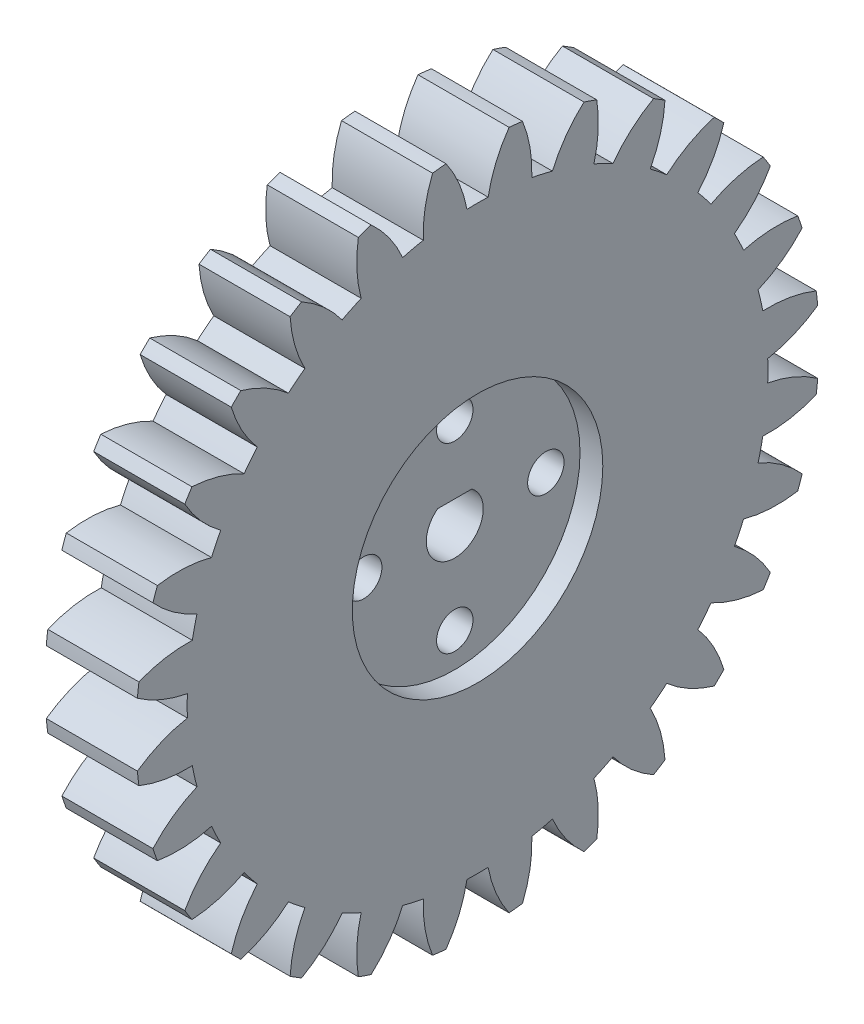
from build123d import *

# Parameters (mm, degrees)
BASPROSKE_W              = 8
BASPROSKE_H              = 30
TOOTHCUT_DEPTH           = 44.17406629
TEETHCUTS_COUNT          = 28
TEETHCUTS_ANGLE          = 347.142857143
BORSKE_R                 = 0.1
BORE_DEPTH               = 50.0000508
TAGLIO_ESTRUSIONE1_DEPTH = 30
SCHIZZO2_R               = 1.6
TAGLIO_ESTRUSIONE2_DEPTH = 10
SCHIZZO3_R               = 11
TAGLIO_ESTRUSIONE3_DEPTH = 2


with BuildPart() as part:
    # BasProSke → Base-Revolve (revolve)
    with BuildSketch(Plane(origin=(0, 0, 0), x_dir=(1, 0, 0), z_dir=(0, 1, 0)), mode=Mode.PRIVATE) as base_revolve_sk:
        with Locations((4, 15)):
            Rectangle(BASPROSKE_W, BASPROSKE_H)
    revolve(base_revolve_sk.sketch.rotate(Axis((-10, 0, 0), (1, 0, 0)), 180), axis=Axis((-10, 0, 0), (1, 0, 0)))

    # TooCutSke → ToothCut (cut, through all)
    with BuildSketch(Plane(origin=(0, 0, 0), x_dir=(0, 0, -1), z_dir=(1, 0, 0))):
        with BuildLine():
            ThreePointArc((0.928503763, 25.482089431), (0, 25.499), (-0.928503763, 25.482089431))
            ThreePointArc((-0.928503763, 25.482089431), (-1.618524429, 27.789411612), (-2.78585155, 29.895880591))
            ThreePointArc((-2.78585155, 29.895880591), (0, 30.0254), (2.78585155, 29.895880591))
            ThreePointArc((2.78585155, 29.895880591), (1.618524429, 27.789411612), (0.928503763, 25.482089431))
        make_face()
    toothcut = extrude(amount=TOOTHCUT_DEPTH, mode=Mode.SUBTRACT)

    # TeethCuts: ToothCut ×28 about axis
    teethcuts_axis = Axis((-10, 0, 0), (1, 0, 0))
    for i in range(1, TEETHCUTS_COUNT):
        add(toothcut.rotate(teethcuts_axis, i * TEETHCUTS_ANGLE / (TEETHCUTS_COUNT - 1)), mode=Mode.SUBTRACT)

    # BorSke → Bore (cut, symmetric)
    with BuildSketch(Plane(origin=(0, 0, 0), x_dir=(0, 0, -1), z_dir=(1, 0, 0))):
        with Locations(Location((0, 0, 0), (0, 0, 180))):
            Circle(BORSKE_R)
    extrude(amount=BORE_DEPTH, both=True, mode=Mode.SUBTRACT)

    # Schizzo1 → Taglio-Estrusione1 (cut)
    with BuildSketch(Plane(origin=(8, 0, 0), x_dir=(0, 0, -1), z_dir=(1, 0, 0))):
        with BuildLine():
            Line((-1.5, 2), (1.5, 2))
            ThreePointArc((1.5, 2), (0, -2.5), (-1.5, 2))
        make_face()
    extrude(amount=-TAGLIO_ESTRUSIONE1_DEPTH, mode=Mode.SUBTRACT)

    # Schizzo2 → Taglio-Estrusione2 (cut)
    with BuildSketch(Plane.ZY):
        with Locations((0, 8)):
            Circle(SCHIZZO2_R)
        with Locations((8, 0)):
            Circle(SCHIZZO2_R)
        with Locations((0, -8)):
            Circle(SCHIZZO2_R)
        with Locations((-8, 0)):
            Circle(SCHIZZO2_R)
    extrude(amount=-TAGLIO_ESTRUSIONE2_DEPTH, mode=Mode.SUBTRACT)

    # Schizzo3 → Taglio-Estrusione3 (cut)
    with BuildSketch(Plane(origin=(8, 0, 0), x_dir=(0, 0, -1), z_dir=(1, 0, 0))):
        Circle(SCHIZZO3_R)
    extrude(amount=-TAGLIO_ESTRUSIONE3_DEPTH, mode=Mode.SUBTRACT)


solid = part.part
